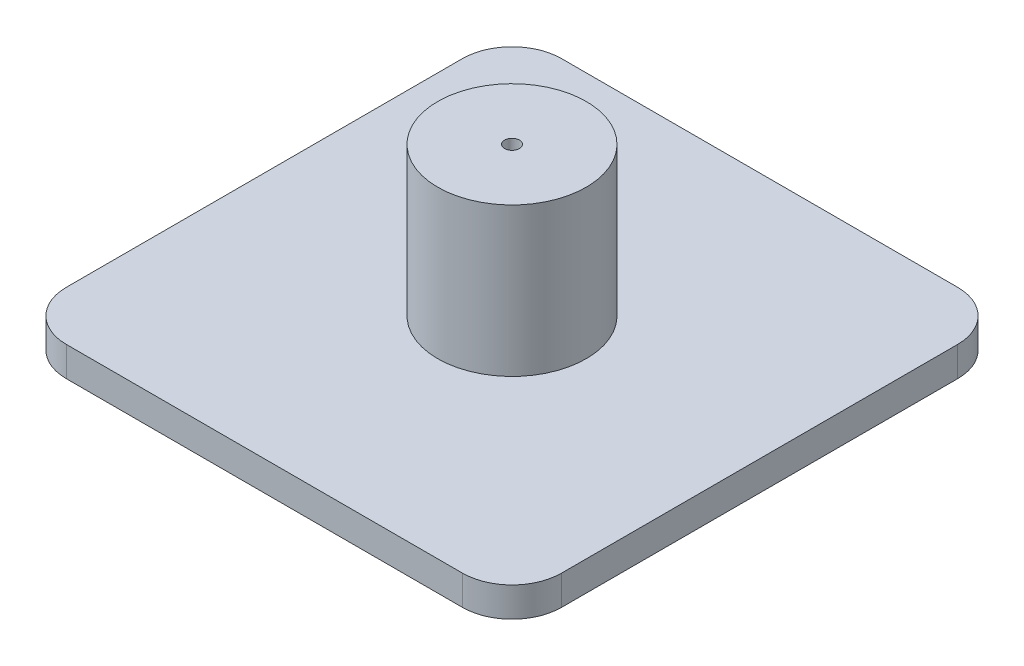
from build123d import *

# Parameters (mm, degrees)
SCHIZZO1_W                   = 50
SCHIZZO1_H                   = 50
ESTRUSIONE_ESTRUSIONE1_DEPTH = 3
RACCORDO1_R                  = 5
SCHIZZO2_R                   = 7.5
ESTRUSIONE_ESTRUSIONE2_DEPTH = 15
SCHIZZO3_R                   = 0.75
TAGLIO_ESTRUSIONE1_DEPTH     = 50.737621267


with BuildPart() as part:
    # Schizzo1 → Estrusione-Estrusione1 (new body)
    with BuildSketch(Plane(origin=(0, 0, 0), x_dir=(1, 0, 0), z_dir=(0, 1, 0))):
        with Locations((9.19152509, -6.317256925)):
            Rectangle(SCHIZZO1_W, SCHIZZO1_H)
    extrude(amount=ESTRUSIONE_ESTRUSIONE1_DEPTH)

    # Raccordo1
    raccordo1_edges = [part.edges().sort_by_distance(p)[0] for p in [
        (-15.80847491, 1.5, -18.682743075),
        (34.19152509, 1.5, -18.682743075),
        (34.19152509, 1.5, 31.317256925),
        (-15.80847491, 1.5, 31.317256925),
    ]]
    fillet(raccordo1_edges, radius=RACCORDO1_R)

    # Schizzo2 → Estrusione-Estrusione2 (add)
    with BuildSketch(Plane(origin=(0, 3, 0), x_dir=(1, 0, 0), z_dir=(0, 1, 0))):
        with Locations(Location((9.19152509, -6.317256925, 0), (0, 0, 270))):
            Circle(SCHIZZO2_R)
    extrude(amount=ESTRUSIONE_ESTRUSIONE2_DEPTH)

    # Schizzo3 → Taglio-Estrusione1 (cut, through all)
    with BuildSketch(Plane(origin=(0, 18, 0), x_dir=(1, 0, 0), z_dir=(0, 1, 0))):
        with Locations(Location((9.19152509, -6.317256925, 0), (0, 0, 270))):
            Circle(SCHIZZO3_R)
    extrude(amount=-TAGLIO_ESTRUSIONE1_DEPTH, mode=Mode.SUBTRACT)


solid = part.part
